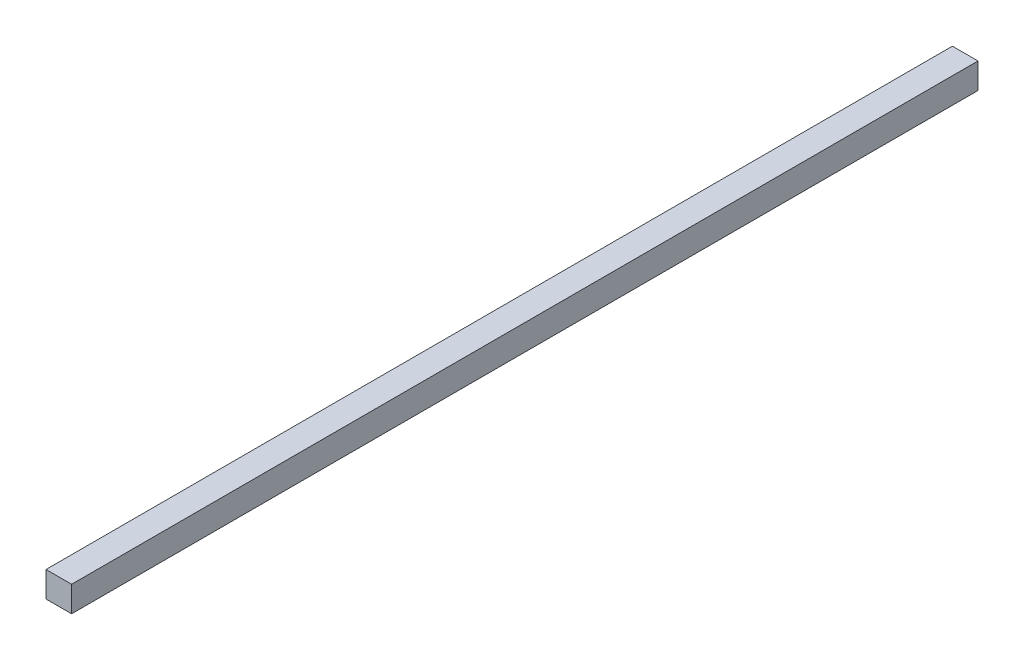
from build123d import *

# Parameters (mm, degrees)
SKETCH2_W           = 6.35
SKETCH2_H           = 6.35
BOSS_EXTRUDE1_DEPTH = 224.79


with BuildPart() as part:
    # Sketch2 → Boss-Extrude1 (new body)
    with BuildSketch(Plane.XY):
        with Locations((3.175, 3.175)):
            Rectangle(SKETCH2_W, SKETCH2_H)
    extrude(amount=BOSS_EXTRUDE1_DEPTH)


solid = part.part
